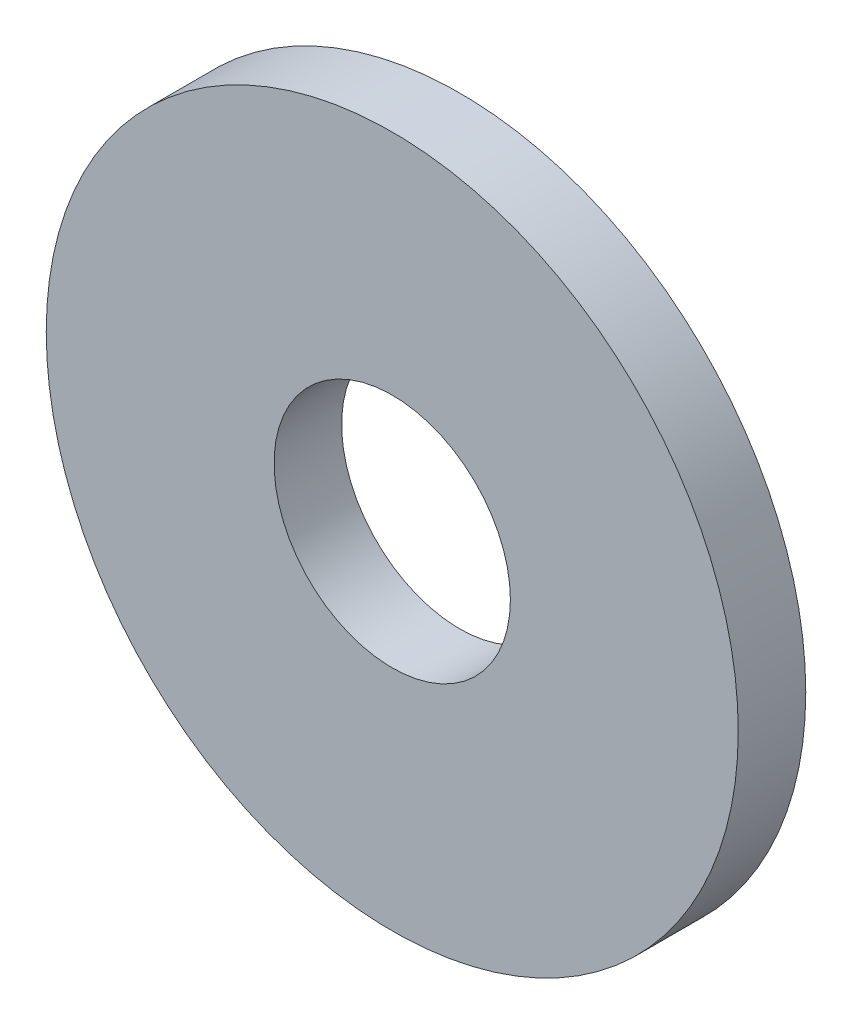
from build123d import *

# Parameters (mm, degrees)
BOSS_EXTRUDE1_DEPTH      = 0.508
BOSS_EXTRUDE1_DEPTH_BACK = 0.508
SKETCH3_R                = 5.207
SKETCH3_R_2              = 1.778


with BuildPart() as part:
    # Sketch3 → Boss-Extrude1 (new, two sides: drawn at the far end of the back side and taken through both)
    with BuildSketch(Plane.XY.offset(-BOSS_EXTRUDE1_DEPTH_BACK)):
        Circle(SKETCH3_R)
        Circle(SKETCH3_R_2, mode=Mode.SUBTRACT)
    extrude(amount=BOSS_EXTRUDE1_DEPTH + BOSS_EXTRUDE1_DEPTH_BACK)


solid = part.part
